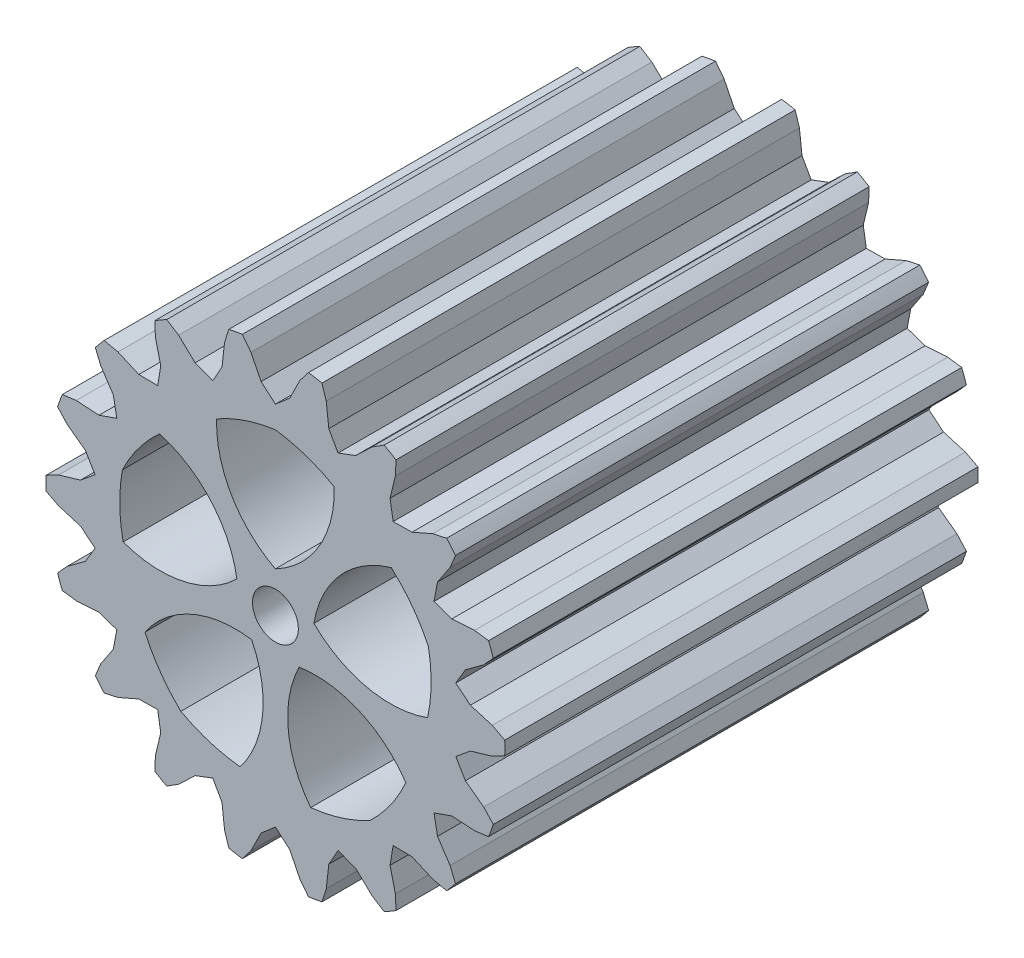
from build123d import *

# Parameters (mm, degrees)
SKETCH1_R               = 16
BOSS_EXTRUDE1_DEPTH     = 33
CUT_EXTRUDE1_DEPTH      = 41.012498047
CUT_EXTRUDE2_DEPTH      = 41.012498047
CUT_EXTRUDE2_DEPTH_BACK = 41.012498047
SKETCH4_R               = 1.6
CIRPATTERN1_COUNT       = 18
CUT_EXTRUDE4_DEPTH      = 40.945958252
CIRPATTERN2_COUNT       = 5


with BuildPart() as part:
    # Sketch1 → Boss-Extrude1 (new body)
    with BuildSketch(Plane.XY):
        Circle(SKETCH1_R)
    extrude(amount=BOSS_EXTRUDE1_DEPTH)

    # Sketch2 → Cut-Extrude1 (cut, through all)
    with BuildSketch(Plane.XY):
        Polygon((0, 12.771256455), (-0.998470792, 13.630683843), (-1.704297747, 15.05174878), (-2.306603416, 15.832863944), (-1.704297747, 16.616063463), (0, 17.330302982), (1.704297747, 16.616063463), (2.306603416, 15.832863944), (1.704297747, 15.05174878), (0.998470792, 13.630683843), align=None)
    cut_extrude1 = extrude(amount=CUT_EXTRUDE1_DEPTH, mode=Mode.SUBTRACT)

    # Sketch4 → Cut-Extrude2 (cut, two sides: drawn at the far end of the back side and taken through both)
    with BuildSketch(Plane.XY.offset(33).offset(-CUT_EXTRUDE2_DEPTH_BACK)):
        Circle(SKETCH4_R)
    extrude(amount=CUT_EXTRUDE2_DEPTH + CUT_EXTRUDE2_DEPTH_BACK, mode=Mode.SUBTRACT)

    # CirPattern1: Cut-Extrude1 ×18 about axis
    cirpattern1_axis = Axis((0, 0, 0), (0, 0, 1))
    for i in range(1, CIRPATTERN1_COUNT):
        add(cut_extrude1.rotate(cirpattern1_axis, i * 360 / CIRPATTERN1_COUNT), mode=Mode.SUBTRACT)

    # Sketch5 → Cut-Extrude4 (cut, symmetric)
    with BuildSketch(Plane.XY):
        with BuildLine():
            ThreePointArc((0, 2.821879594), (-3.06229646, 5.734687868), (-4.100588226, 9.831523459))
            ThreePointArc((-4.100588226, 9.831523459), (-2.118596194, 10.7277447), (0, 11.220750878))
            ThreePointArc((0, 11.220750878), (2.118596194, 10.7277447), (4.100588226, 9.831523459))
            ThreePointArc((4.100588226, 9.831523459), (3.06229646, 5.734687868), (0, 2.821879594))
        make_face()
    cut_extrude4 = extrude(amount=CUT_EXTRUDE4_DEPTH, both=True, mode=Mode.SUBTRACT)

    # CirPattern2: Cut-Extrude4 ×5 about axis
    cirpattern2_axis = Axis((0, 0, 0), (0, 0, 1))
    for i in range(1, CIRPATTERN2_COUNT):
        add(cut_extrude4.rotate(cirpattern2_axis, i * 360 / CIRPATTERN2_COUNT), mode=Mode.SUBTRACT)


solid = part.part
